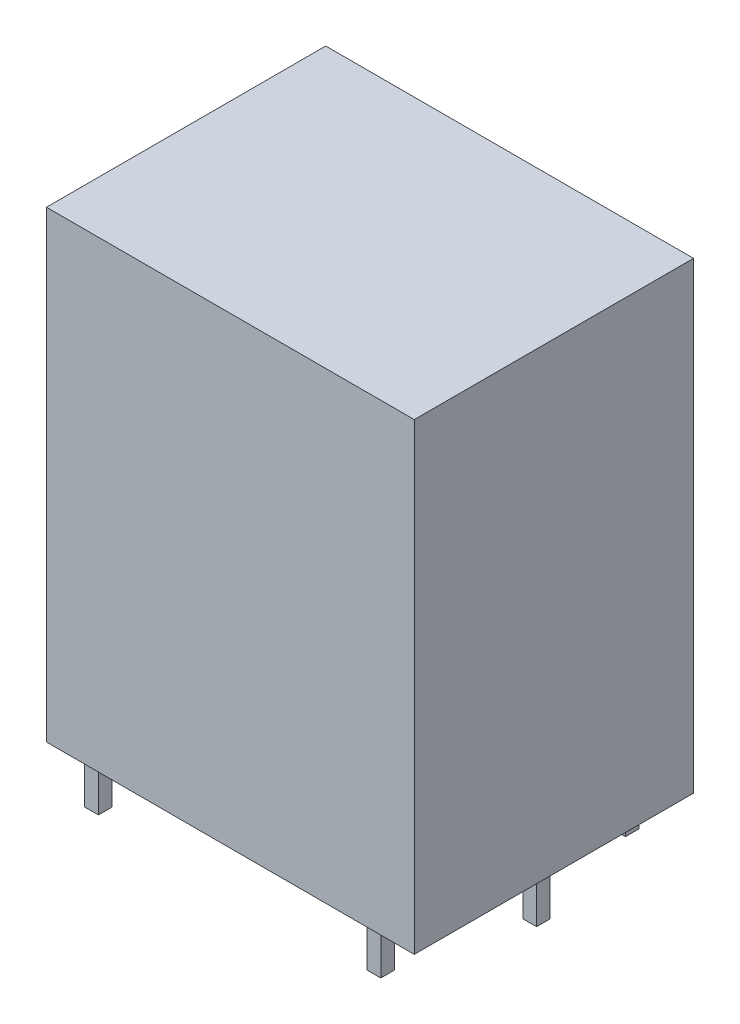
from build123d import *

# Parameters (mm, degrees)
SKETCH_1_W      = 27
SKETCH_1_H      = 20.5
EXTRUDE_1_DEPTH = 34
SKETCH_2_W      = 1
SKETCH_2_H      = 1
EXTRUDE_2_DEPTH = 3.5


with BuildPart() as part:
    # 草图1 → 拉伸1 (new body)
    with BuildSketch(Plane(origin=(0, 0, 0), x_dir=(1, 0, 0), z_dir=(0, 1, 0))):
        Rectangle(SKETCH_1_W, SKETCH_1_H)
    extrude(amount=EXTRUDE_1_DEPTH)

    # 草图2 → 拉伸2 (add)
    with BuildSketch(Plane.XZ):
        with Locations((12.23, 0)):
            Rectangle(SKETCH_2_W, SKETCH_2_H)
        with Locations((9.77, 8.98)):
            Rectangle(SKETCH_2_W, SKETCH_2_H)
        with Locations((-10.96, 8.98)):
            Rectangle(SKETCH_2_W, SKETCH_2_H)
        with Locations((-10.96, -8.98)):
            Rectangle(SKETCH_2_W, SKETCH_2_H)
        with Locations((9.77, -8.98)):
            Rectangle(SKETCH_2_W, SKETCH_2_H)
    extrude(amount=EXTRUDE_2_DEPTH)


solid = part.part
